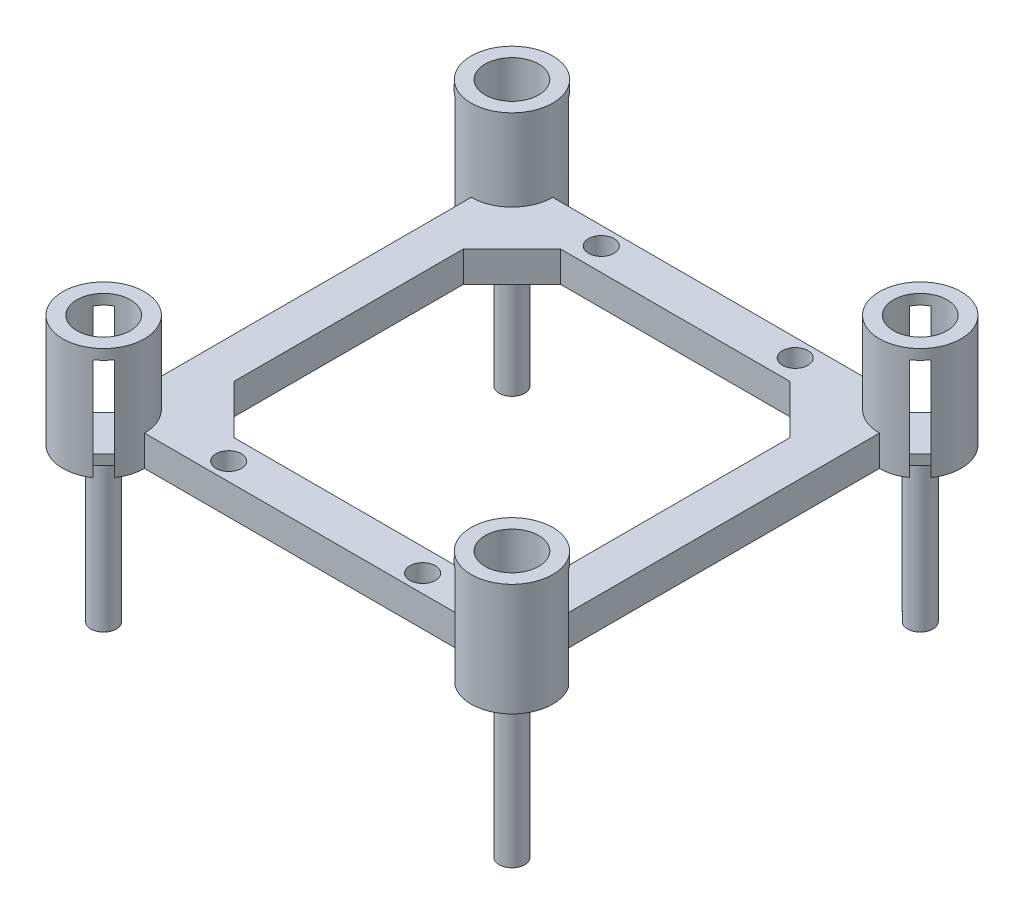
from build123d import *

# Parameters (mm, degrees)
BOSS_EXTRUDE1_DEPTH      = 6
SKETCH2_R                = 2.5
CUT_EXTRUDE1_DEPTH       = 69.14690015
BOSS_EXTRUDE2_DEPTH      = 16
BOSS_EXTRUDE2_DEPTH_BACK = 4
SKETCH4_R                = 8
CUT_EXTRUDE2_DEPTH       = 20
SKETCH7_R                = 5.25
CUT_EXTRUDE3_DEPTH       = 20
SKETCH8_R                = 2.5
BOSS_EXTRUDE3_DEPTH      = 30


with BuildPart() as part:
    # Sketch1 → Boss-Extrude1 (new body)
    with BuildSketch(Plane(origin=(0, 0, 0), x_dir=(1, 0, 0), z_dir=(0, 1, 0))):
        with BuildLine():
            Line((-32, -40), (32, -40))
            ThreePointArc((32, -40), (45.656854249, -45.656854249), (40, -32))
            Line((40, -32), (40, 32))
            ThreePointArc((40, 32), (45.656854249, 45.656854249), (32, 40))
            Line((32, 40), (-32, 40))
            ThreePointArc((-32, 40), (-45.656854249, 45.656854249), (-40, 32))
            Line((-40, 32), (-40, -32))
            ThreePointArc((-40, -32), (-45.656854249, -45.656854249), (-32, -40))
        make_face()
        Polygon((-22.5, 32), (22.5, 32), (32, 22.5), (32, -22.5), (22.5, -32), (-22.5, -32), (-32, -22.5), (-32, 22.5), align=None, mode=Mode.SUBTRACT)
    extrude(amount=BOSS_EXTRUDE1_DEPTH)

    # Sketch2 → Cut-Extrude1 (cut, through all)
    with BuildSketch(Plane.XZ):
        with Locations(Location((-19, -36.5, 0), (0, 0, 270))):
            Circle(SKETCH2_R)
        with Locations(Location((19, -36.5, 0), (0, 0, 270))):
            Circle(SKETCH2_R)
        with Locations(Location((19, 36.5, 0), (0, 0, 270))):
            Circle(SKETCH2_R)
        with Locations(Location((-19, 36.5, 0), (0, 0, 270))):
            Circle(SKETCH2_R)
    extrude(amount=-CUT_EXTRUDE1_DEPTH, mode=Mode.SUBTRACT)

    # Sketch4 → Boss-Extrude2 (add, two sides: drawn at the far end of the back side and taken through both)
    with BuildSketch(Plane(origin=(0, 6, 0), x_dir=(1, 0, 0), z_dir=(0, 1, 0)).offset(-BOSS_EXTRUDE2_DEPTH_BACK)):
        with Locations(Location((-40, 40, 0), (0, 0, 270))):
            Circle(SKETCH4_R)
        with Locations(Location((40, 40, 0), (0, 0, 270))):
            Circle(SKETCH4_R)
        with Locations(Location((40, -40, 0), (0, 0, 90))):
            Circle(SKETCH4_R)
        with Locations(Location((-40, -40, 0), (0, 0, 90))):
            Circle(SKETCH4_R)
    extrude(amount=BOSS_EXTRUDE2_DEPTH + BOSS_EXTRUDE2_DEPTH_BACK)

    # Sketch5 → Cut-Extrude2 (cut)
    with BuildSketch(Plane.XZ):
        with BuildLine():
            Line((-35.504132479, 46.617187865), (-37.525126266, 44.596194078))
            Line((-37.525126266, 44.596194078), (-35.403805922, 42.474873734))
            Line((-35.403805922, 42.474873734), (-33.382812135, 44.495867521))
            ThreePointArc((-33.382812135, 44.495867521), (-34.343145751, 45.656854249), (-35.504132479, 46.617187865))
        make_face()
        with BuildLine():
            Line((-44.596194078, 37.525126266), (-46.617187865, 35.504132479))
            ThreePointArc((-46.617187865, 35.504132479), (-45.656854249, 34.343145751), (-44.495867521, 33.382812135))
            Line((-44.495867521, 33.382812135), (-42.474873734, 35.403805922))
            Line((-42.474873734, 35.403805922), (-44.596194078, 37.525126266))
        make_face()
        with BuildLine():
            Line((35.403805922, 42.474873734), (37.525126266, 44.596194078))
            Line((37.525126266, 44.596194078), (35.504132479, 46.617187865))
            ThreePointArc((35.504132479, 46.617187865), (34.343145751, 45.656854249), (33.382812135, 44.495867521))
            Line((33.382812135, 44.495867521), (35.403805922, 42.474873734))
        make_face()
        with BuildLine():
            ThreePointArc((44.495867521, 33.382812135), (45.656854249, 34.343145751), (46.617187865, 35.504132479))
            Line((46.617187865, 35.504132479), (44.596194078, 37.525126266))
            Line((44.596194078, 37.525126266), (42.474873734, 35.403805922))
            Line((42.474873734, 35.403805922), (44.495867521, 33.382812135))
        make_face()
        with BuildLine():
            Line((44.596194078, -37.525126266), (46.617187865, -35.504132479))
            ThreePointArc((46.617187865, -35.504132479), (45.656854249, -34.343145751), (44.495867521, -33.382812135))
            Line((44.495867521, -33.382812135), (42.474873734, -35.403805922))
            Line((42.474873734, -35.403805922), (44.596194078, -37.525126266))
        make_face()
        with BuildLine():
            Line((35.504132479, -46.617187865), (37.525126266, -44.596194078))
            Line((37.525126266, -44.596194078), (35.403805922, -42.474873734))
            Line((35.403805922, -42.474873734), (33.382812135, -44.495867521))
            ThreePointArc((33.382812135, -44.495867521), (34.343145751, -45.656854249), (35.504132479, -46.617187865))
        make_face()
        with BuildLine():
            ThreePointArc((-44.495867521, -33.382812135), (-45.656854249, -34.343145751), (-46.617187865, -35.504132479))
            Line((-46.617187865, -35.504132479), (-44.596194078, -37.525126266))
            Line((-44.596194078, -37.525126266), (-42.474873734, -35.403805922))
            Line((-42.474873734, -35.403805922), (-44.495867521, -33.382812135))
        make_face()
        with BuildLine():
            Line((-35.403805922, -42.474873734), (-37.525126266, -44.596194078))
            Line((-37.525126266, -44.596194078), (-35.504132479, -46.617187865))
            ThreePointArc((-35.504132479, -46.617187865), (-34.343145751, -45.656854249), (-33.382812135, -44.495867521))
            Line((-33.382812135, -44.495867521), (-35.403805922, -42.474873734))
        make_face()
    extrude(amount=-CUT_EXTRUDE2_DEPTH, mode=Mode.SUBTRACT)

    # Sketch7 → Cut-Extrude3 (cut)
    with BuildSketch(Plane(origin=(0, 22, 0), x_dir=(1, 0, 0), z_dir=(0, 1, 0))):
        with Locations(Location((40, 40, 0), (0, 0, 270))):
            Circle(SKETCH7_R)
        with Locations(Location((40, -40, 0), (0, 0, 270))):
            Circle(SKETCH7_R)
        with Locations(Location((-40, -40, 0), (0, 0, 270))):
            Circle(SKETCH7_R)
        with Locations(Location((-40, 40, 0), (0, 0, 270))):
            Circle(SKETCH7_R)
    extrude(amount=-CUT_EXTRUDE3_DEPTH, mode=Mode.SUBTRACT)

    # Sketch8 → Boss-Extrude3 (add)
    with BuildSketch(Plane.XZ):
        with Locations(Location((-40, 40, 0), (0, 0, 90))):
            Circle(SKETCH8_R)
        with Locations(Location((40, 40, 0), (0, 0, 90))):
            Circle(SKETCH8_R)
        with Locations(Location((40, -40, 0), (0, 0, 90))):
            Circle(SKETCH8_R)
        with Locations(Location((-40, -40, 0), (0, 0, 90))):
            Circle(SKETCH8_R)
    extrude(amount=BOSS_EXTRUDE3_DEPTH)


solid = part.part
